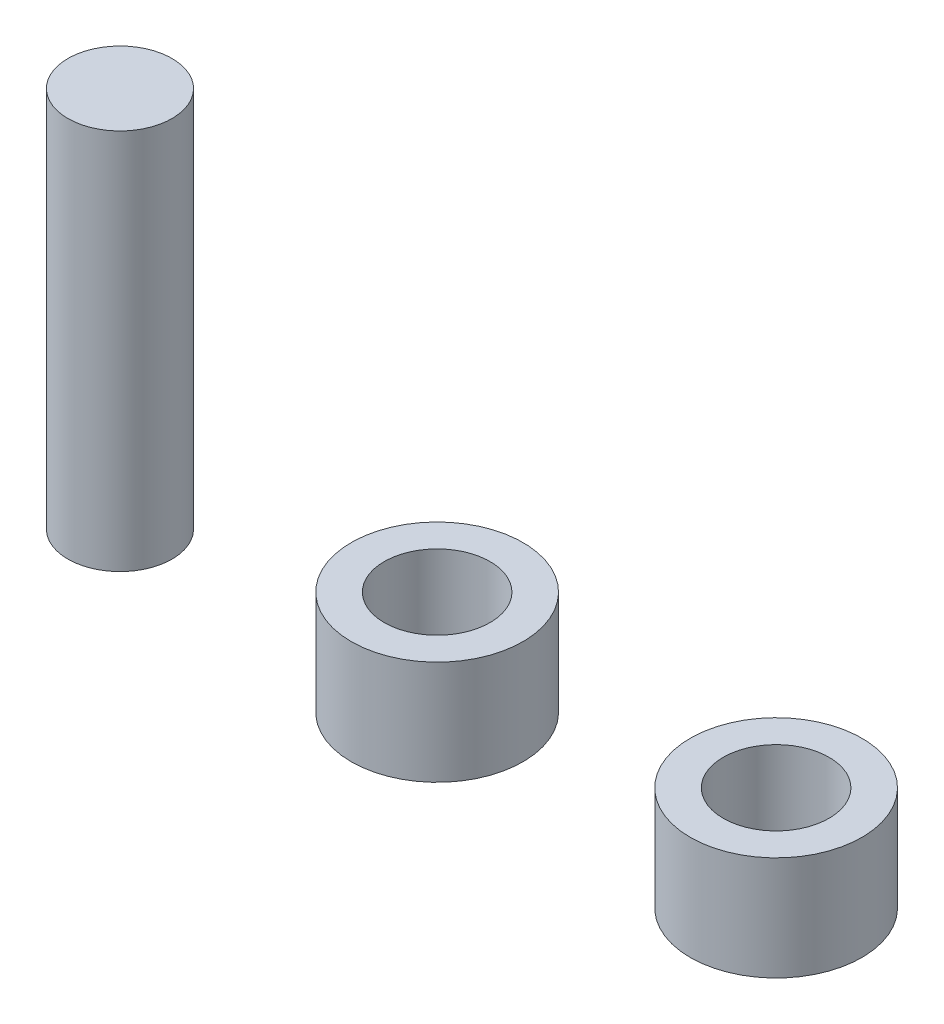
from build123d import *

# Parameters (mm, degrees)
SKETCH1_R           = 2.475
SKETCH1_R_2         = 1.525
BOSS_EXTRUDE1_DEPTH = 3
SKETCH2_R           = 1.5
BOSS_EXTRUDE2_DEPTH = 11


with BuildPart() as part:
    # Sketch1 → Boss-Extrude1 (new body)
    with BuildSketch(Plane(origin=(0, 0, 0), x_dir=(1, 0, 0), z_dir=(0, 1, 0))):
        with Locations(Location((0.114586476, 0, 0), (0, 0, 270))):
            Circle(SKETCH1_R)
        with Locations(Location((0.114586476, 0, 0), (0, 0, 270))):
            Circle(SKETCH1_R_2, mode=Mode.SUBTRACT)
    extrude(amount=BOSS_EXTRUDE1_DEPTH)


with BuildPart() as body_2:
    # Sketch2 → Boss-Extrude2 (new body)
    with BuildSketch(Plane(origin=(0, 0, 0), x_dir=(1, 0, 0), z_dir=(0, 1, 0))):
        with Locations(Location((-9.027296586, 0, 0), (0, 0, 270))):
            Circle(SKETCH2_R)
    extrude(amount=BOSS_EXTRUDE2_DEPTH)


with BuildPart() as body_3:
    # Mirror1: mirrored copy
    add(part.part.mirror(Plane(origin=(5, 0, 0), x_dir=(0, 0, 1), z_dir=(1, 0, 0))))


solid = Compound([part.part, body_2.part, body_3.part])
